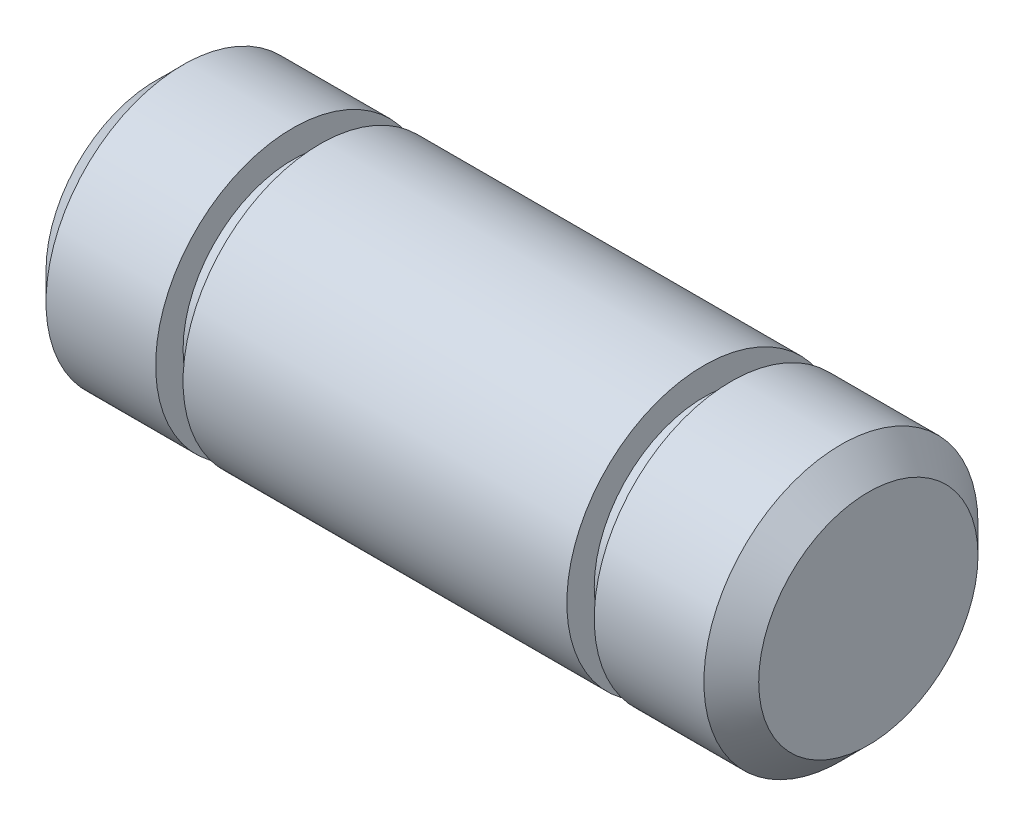
from build123d import *


with BuildPart() as part:
    # Sketch1 → Revolve1 (revolve)
    with BuildSketch(Plane(origin=(0, 0, 0), x_dir=(1, 0, 0), z_dir=(0, 1, 0))):
        Polygon((0, 0), (0, 4), (1, 5), (5, 5), (5, 4), (6, 4), (6, 5), (20, 5), (20, 4), (21, 4), (21, 5), (25, 5), (26, 4), (26, 0), align=None)
    revolve(axis=Axis((26, 0, 0), (-1, 0, 0)))


solid = part.part
